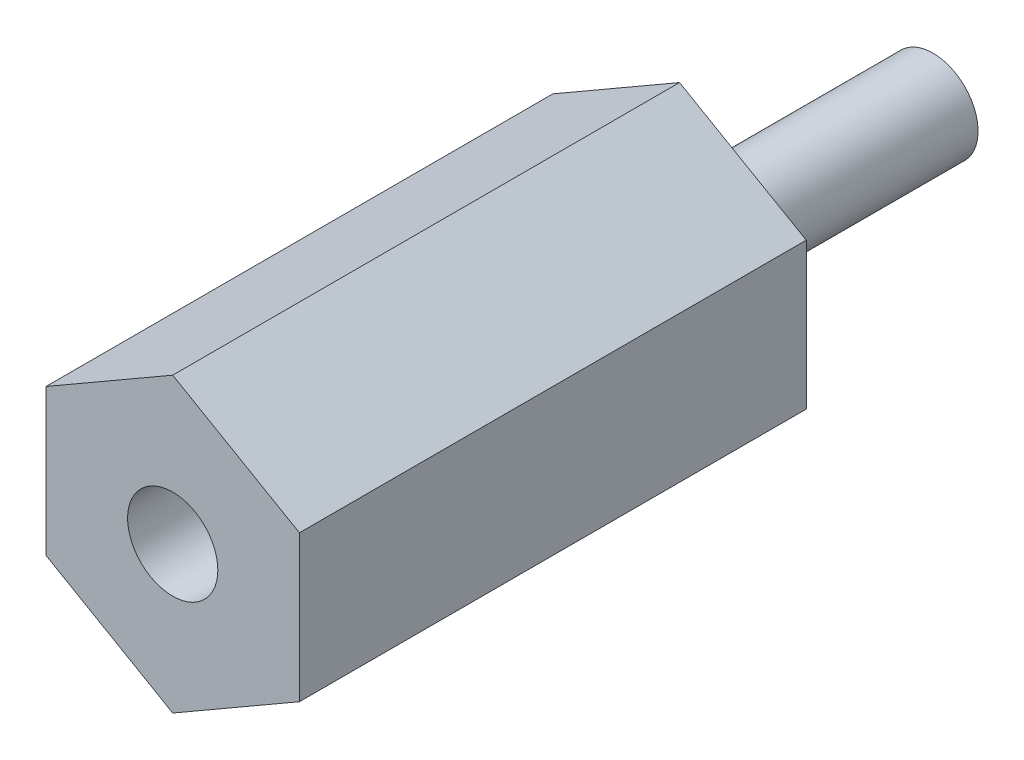
from build123d import *

# Parameters (mm, degrees)
BOSS_EXTRUDE1_DEPTH           = 12.7
TAP_DRILL_FOR_4_40_TAP1_D     = 2.2606
TAP_DRILL_FOR_4_40_TAP1_DEPTH = 12.7
TAP_DRILL_FOR_4_40_TAP1_TIP   = 0.679152758
BOSS_EXTRUDE2_START           = 6.35
SKETCH5_R                     = 1.1303
BOSS_EXTRUDE2_DEPTH           = 6.35


with BuildPart() as part:
    # Sketch1 → Boss-Extrude1 (new body)
    with BuildSketch(Plane.XY):
        Polygon((0, 3.666174209), (-3.175, 1.833087105), (-3.175, -1.833087105), (0, -3.666174209), (3.175, -1.833087105), (3.175, 1.833087105), align=None)
    extrude(amount=BOSS_EXTRUDE1_DEPTH)

    # Tap Drill for #4-40 Tap1
    with Locations(Plane.XY.offset(12.7)):
        with Locations((0, 0)):
            Hole(TAP_DRILL_FOR_4_40_TAP1_D / 2, depth=TAP_DRILL_FOR_4_40_TAP1_DEPTH)
            with Locations((0, 0, -(TAP_DRILL_FOR_4_40_TAP1_DEPTH + TAP_DRILL_FOR_4_40_TAP1_TIP / 2))):  # 118° drill point
                Cone(0, TAP_DRILL_FOR_4_40_TAP1_D / 2, TAP_DRILL_FOR_4_40_TAP1_TIP, mode=Mode.SUBTRACT)


with BuildPart() as body_2:
    # Sketch5 → Boss-Extrude2 (new body)
    with BuildSketch(Plane(origin=(0, 0, 0), x_dir=(-1, 0, 0), z_dir=(0, 0, -1)).offset(BOSS_EXTRUDE2_START)):
        Circle(SKETCH5_R)
    extrude(amount=-BOSS_EXTRUDE2_DEPTH)


solid = Compound([part.part, body_2.part])
